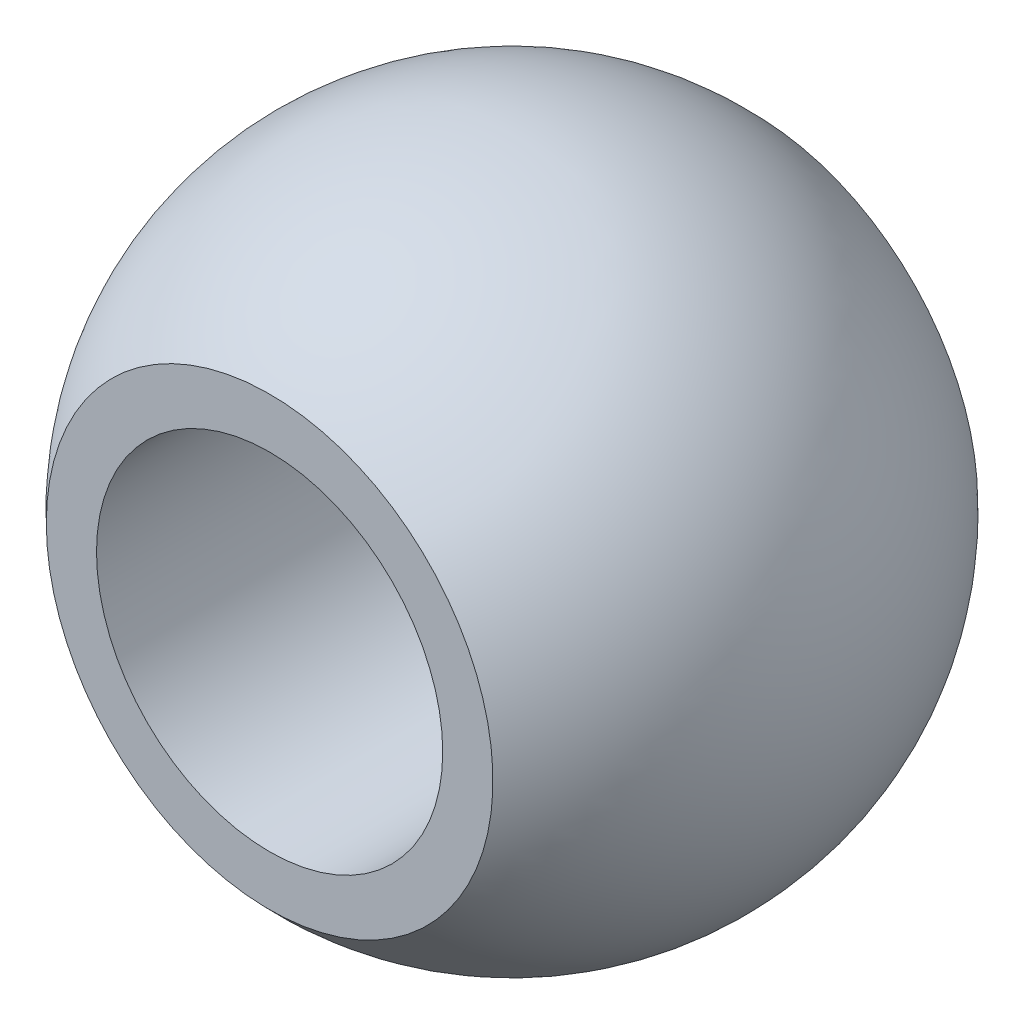
from build123d import *

# Parameters (mm, degrees)
SKETCH2_R          = 5
CUT_EXTRUDE1_DEPTH = 17.5
CUT_EXTRUDE2_DEPTH = 13.5


with BuildPart() as part:
    # Sketch1 → Revolve1 (revolve)
    with BuildSketch(Plane.XY):
        with BuildLine():
            Line((0, -9.51853455), (0, 9.51853455))
            ThreePointArc((0, 9.51853455), (9.51853455, 0), (0, -9.51853455))
        make_face()
    revolve(axis=Axis((0, -9.51853455, 0), (0, 1, 0)))

    # Sketch2 → Cut-Extrude1 (cut, symmetric)
    with BuildSketch(Plane.XY):
        with Locations(Location((0, 0, 0), (0, 0, 180))):
            Circle(SKETCH2_R)
    extrude(amount=CUT_EXTRUDE1_DEPTH, both=True, mode=Mode.SUBTRACT)

    # Sketch3 → Cut-Extrude2 (cut, symmetric)
    with BuildSketch(Plane(origin=(0, 0, 0), x_dir=(1, 0, 0), z_dir=(0, 1, 0))):
        Polygon((0, 7), (11.333414606, 7), (11.333414606, 9.218224995), (-12.305258481, 9.218224995), (-12.305258481, 7), align=None)
        Polygon((0, -7), (12.676845845, -7), (12.676845845, -8.960972204), (-12.048005691, -8.960972204), (-12.048005691, -7), align=None)
    extrude(amount=CUT_EXTRUDE2_DEPTH, both=True, mode=Mode.SUBTRACT)


solid = part.part
